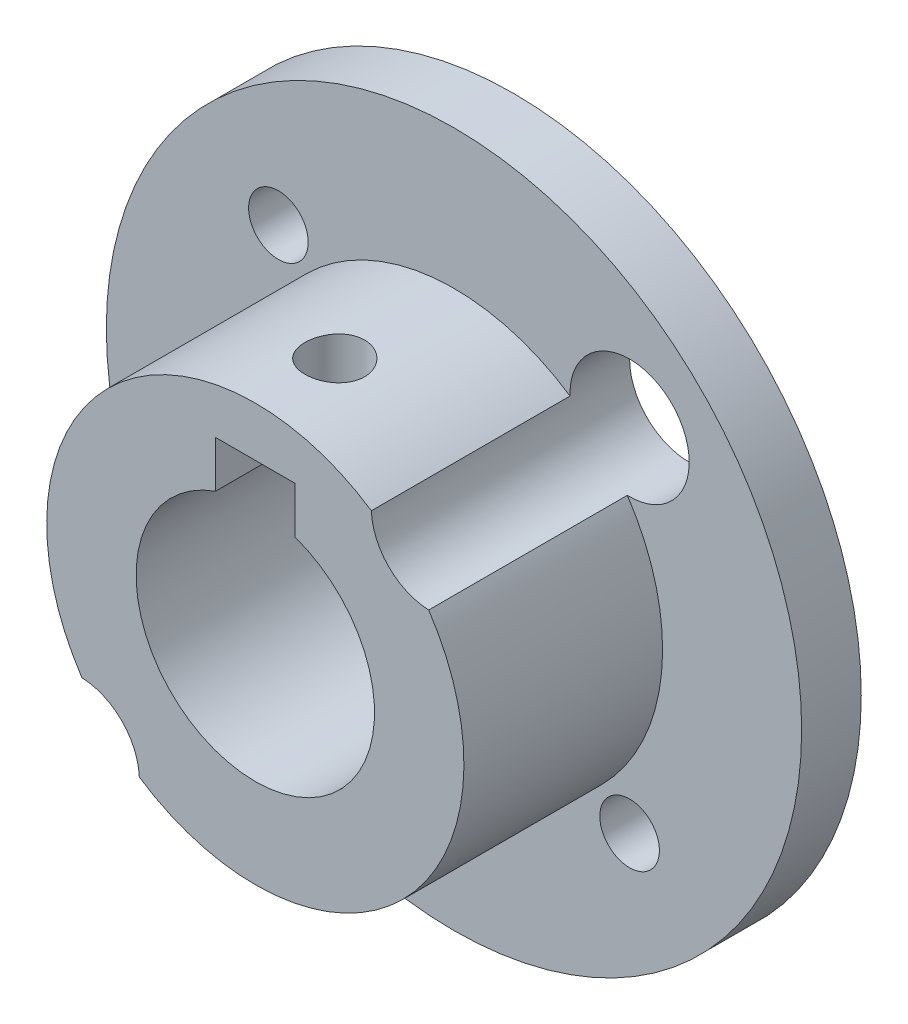
from build123d import *

# Parameters (mm, degrees)
SKETCH_1_R               = 10.5
EXTRUDE_1_DEPTH          = 10
EXTRUDE_START            = 3
SKETCH_3_R               = 17.5
EXTRUDE_1_2_DEPTH        = 3
SKETCH_4_R               = 1.5
SKETCH_4_R_2             = 3
CUT_EXTRUDE_1_DEPTH      = 28.955321497
CUT_EXTRUDE_2_REACH      = 34.504
CUT_EXTRUDE_2_END_RADIUS = 10.5
SKETCH_5_R               = 1.5


with BuildPart() as part:
    # 草图1 → Extrude 1 (new body)
    with BuildSketch(Plane.XY):
        Circle(SKETCH_1_R)
        with BuildLine():
            Line((-2, 8), (2, 8))
            Line((2, 8), (2, 5.656854249))
            ThreePointArc((2, 5.656854249), (0, -6), (-2, 5.656854249))
            Line((-2, 5.656854249), (-2, 8))
        make_face(mode=Mode.SUBTRACT)
    extrude(amount=EXTRUDE_1_DEPTH)

    # 草图3 → Extrude 1 2 (add)
    with BuildSketch(Plane(origin=(0, 0, 0), x_dir=(-1, 0, 0), z_dir=(0, 0, -1)).offset(EXTRUDE_START)):
        Circle(SKETCH_3_R)
        with BuildLine():
            Line((2, 8), (2, 5.656854249))
            ThreePointArc((2, 5.656854249), (0, -6), (-2, 5.656854249))
            Line((-2, 5.656854249), (-2, 8))
            Line((-2, 8), (2, 8))
        make_face(mode=Mode.SUBTRACT)
    extrude(amount=-EXTRUDE_1_2_DEPTH)

    # 草图4 → 切除-拉伸1 (cut, through all)
    with BuildSketch(Plane(origin=(0, 0, -3), x_dir=(-1, 0, 0), z_dir=(0, 0, -1))):
        with Locations((8.838834765, 8.838834765)):
            Circle(SKETCH_4_R)
        with Locations((-8.838834765, 8.838834765)):
            Circle(SKETCH_4_R_2)
        with Locations(Location((8.838834765, -8.838834765, 0), (0, 0, 92.166571934))):
            Circle(SKETCH_4_R_2)
        with Locations((-8.838834765, -8.838834765)):
            Circle(SKETCH_4_R)
    extrude(amount=-CUT_EXTRUDE_1_DEPTH, mode=Mode.SUBTRACT)

    # 切除-拉伸2: up to this cylinder (the profile starts inside it)
    cut_extrude_2_end = Plane(origin=(0, 0, 6), z_dir=(0, 0, -1)) * Cylinder(CUT_EXTRUDE_2_END_RADIUS, 91.008, mode=Mode.PRIVATE)
    # 草图5 → 切除-拉伸2 (cut, up to the surface)
    with BuildSketch(Plane.XZ.offset(-8), mode=Mode.PRIVATE) as cut_extrude_2_sk1:
        with Locations(Location((0, 6, 0), (0, 0, 270))):
            Circle(SKETCH_5_R)
    cut_extrude_2_tool1 = extrude(cut_extrude_2_sk1.sketch, amount=-CUT_EXTRUDE_2_REACH, mode=Mode.PRIVATE) & cut_extrude_2_end
    add(cut_extrude_2_tool1.solids().sort_by_distance((0, 8, 6))[0], mode=Mode.SUBTRACT)


solid = part.part
